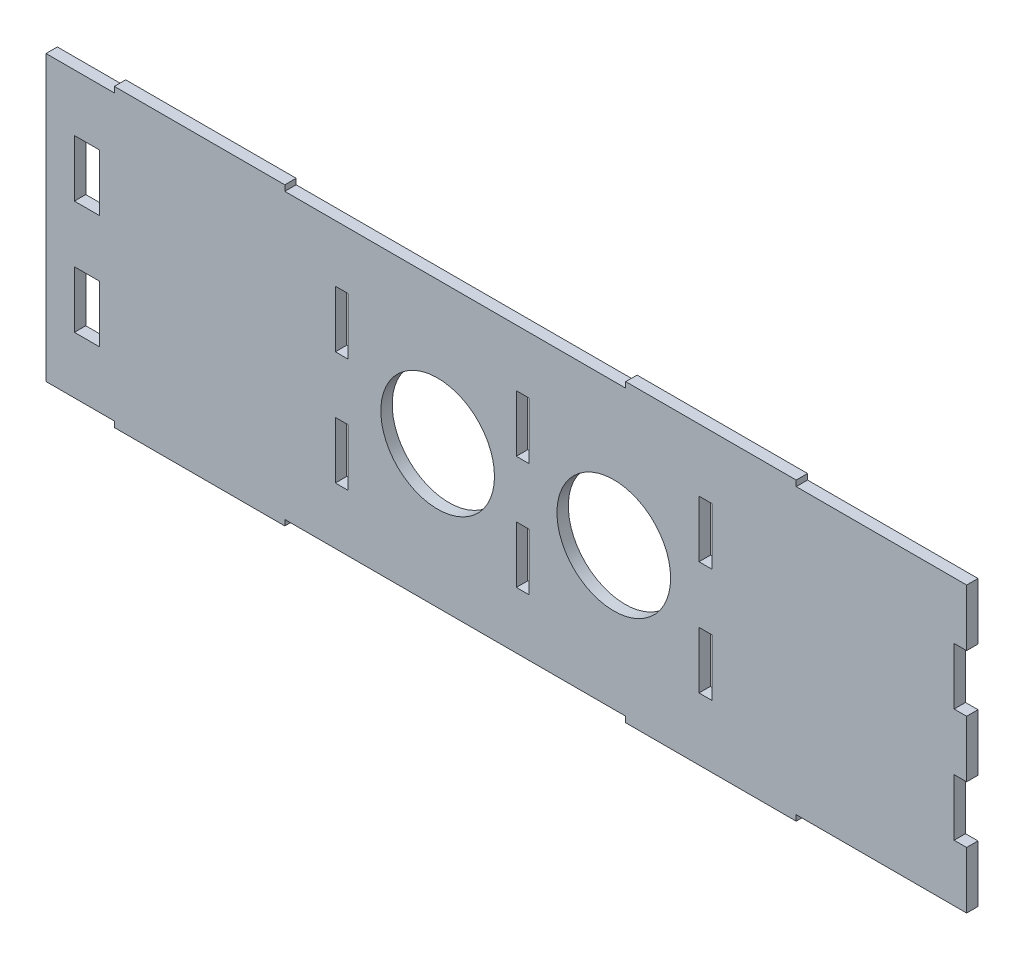
from build123d import *

# Parameters (mm, degrees)
MODEL_R         = 10
MODEL_W         = 4.4
MODEL_H         = 10
EXTRUDE_1_DEPTH = 2


with BuildPart() as part:
    # Model → 凸台-拉伸1 (new body)
    with BuildSketch(Plane.XY):
        Polygon((13.943428414, 55.11082042), (18.943428414, 55.11082042), (18.943428414, 56.11082042), (48.943428414, 56.11082042), (48.943428414, 55.11082042), (108.943428414, 55.11082042), (108.943428414, 56.11082042), (138.943428414, 56.11082042), (138.943428414, 55.11082042), (168.943428414, 55.11082042), (168.943428414, 45.11082042), (166.743428414, 45.11082042), (166.743428414, 35.11082042), (168.943428414, 35.11082042), (168.943428414, 25.11082042), (166.743428414, 25.11082042), (166.743428414, 15.11082042), (168.943428414, 15.11082042), (168.943428414, 5.11082042), (138.943428414, 5.11082042), (138.943428414, 4.11082042), (108.943428414, 4.11082042), (108.943428414, 5.11082042), (61.943428414, 5.11082042), (55.943428414, 5.11082042), (48.943428414, 5.11082042), (48.943428414, 4.11082042), (18.943428414, 4.11082042), (18.943428414, 5.11082042), (6.91562917, 5.11082042), (6.91562917, 55.11082042), align=None)
        with Locations((75.843428414, 30.11082042)):
            Circle(MODEL_R, mode=Mode.SUBTRACT)
        with Locations((106.843428414, 30.11082042)):
            Circle(MODEL_R, mode=Mode.SUBTRACT)
        Polygon((89.690784519, 25.117395738), (91.890784519, 25.108786537), (91.89091955, 15.117786537), (89.690784519, 15.117786537), align=None, mode=Mode.SUBTRACT)
        Polygon((89.690784519, 45.110819609), (91.890784519, 45.102210408), (91.890784519, 35.110819609), (89.690784519, 35.110819609), align=None, mode=Mode.SUBTRACT)
        Polygon((121.843427205, 45.110819609), (124.143292174, 45.101819609), (124.143427205, 35.110819609), (121.843427205, 35.110819609), align=None, mode=Mode.SUBTRACT)
        Polygon((121.843427205, 25.110819609), (124.143292174, 25.101819609), (124.143427205, 15.110819609), (121.843427205, 15.110819609), align=None, mode=Mode.SUBTRACT)
        Polygon((57.844211187, 45.110819609), (60.044211187, 45.11081939), (60.044211187, 35.110819675), (57.844211187, 35.1108198), align=None, mode=Mode.SUBTRACT)
        Polygon((57.844211187, 25.110819609), (60.044211187, 25.11081939), (60.044211187, 15.110819675), (57.844211187, 15.1108198), align=None, mode=Mode.SUBTRACT)
        with Locations((14.11562917, 40.110820275)):
            Rectangle(MODEL_W, MODEL_H, mode=Mode.SUBTRACT)
        with Locations((14.11562917, 20.110820275)):
            Rectangle(MODEL_W, MODEL_H, mode=Mode.SUBTRACT)
    extrude(amount=EXTRUDE_1_DEPTH)


solid = part.part
